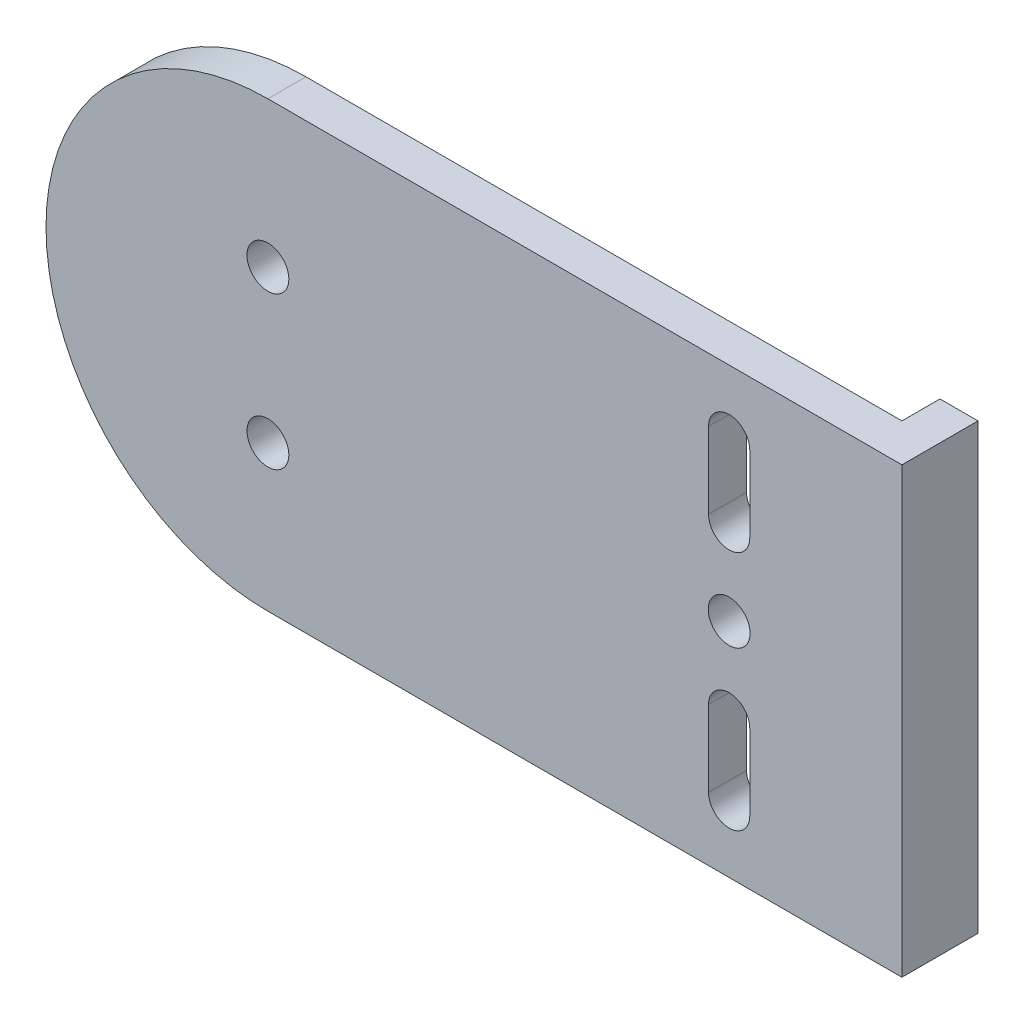
from build123d import *

# Parameters (mm, degrees)
SKETCH_1_R      = 1.65
EXTRUDE_1_DEPTH = 3
SKETCH_2_W      = 3
SKETCH_2_H      = 35
EXTRUDE_2_DEPTH = 6


with BuildPart() as part:
    # 草图1 → 凸台-拉伸1 (new body)
    with BuildSketch(Plane.XY):
        with BuildLine():
            Line((0, 17.5), (50, 17.5))
            Line((50, 17.5), (50, -17.5))
            Line((50, -17.5), (0, -17.5))
            ThreePointArc((0, -17.5), (-17.5, 0), (0, 17.5))
        make_face()
        with Locations((36.375, 0)):
            Circle(SKETCH_1_R, mode=Mode.SUBTRACT)
        with Locations((0, 6)):
            Circle(SKETCH_1_R, mode=Mode.SUBTRACT)
        with Locations((0, -6)):
            Circle(SKETCH_1_R, mode=Mode.SUBTRACT)
        with BuildLine():
            Line((34.75, 12.5), (34.75, 6.5))
            ThreePointArc((34.75, 6.5), (36.375, 4.875), (38, 6.5))
            Line((38, 6.5), (38, 12.5))
            ThreePointArc((38, 12.5), (36.375, 14.125), (34.75, 12.5))
        make_face(mode=Mode.SUBTRACT)
        with BuildLine():
            Line((34.75, -6.5), (34.75, -12.5))
            ThreePointArc((34.75, -12.5), (36.375, -14.125), (38, -12.5))
            Line((38, -12.5), (38, -6.5))
            ThreePointArc((38, -6.5), (36.375, -4.875), (34.75, -6.5))
        make_face(mode=Mode.SUBTRACT)
    extrude(amount=EXTRUDE_1_DEPTH)

    # 草图2 → 凸台-拉伸2 (add)
    with BuildSketch(Plane.XY.offset(3)):
        with Locations((48.5, 0)):
            Rectangle(SKETCH_2_W, SKETCH_2_H)
    extrude(amount=-EXTRUDE_2_DEPTH)


solid = part.part
